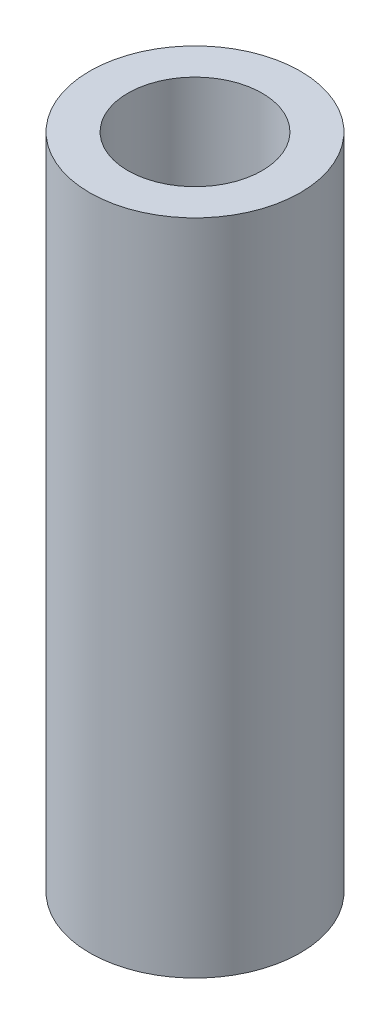
from build123d import *

# Parameters (mm, degrees)
SKETCH1_R           = 4
SKETCH1_R_2         = 2.55
BOSS_EXTRUDE1_DEPTH = 25


with BuildPart() as part:
    # Sketch1 → Boss-Extrude1 (new body)
    with BuildSketch(Plane(origin=(0, 0, 0), x_dir=(1, 0, 0), z_dir=(0, 1, 0))):
        with Locations(Location((0, 0, 0), (0, 0, 270))):
            Circle(SKETCH1_R)
        with Locations(Location((0, 0, 0), (0, 0, 270))):
            Circle(SKETCH1_R_2, mode=Mode.SUBTRACT)
    extrude(amount=BOSS_EXTRUDE1_DEPTH)


solid = part.part
